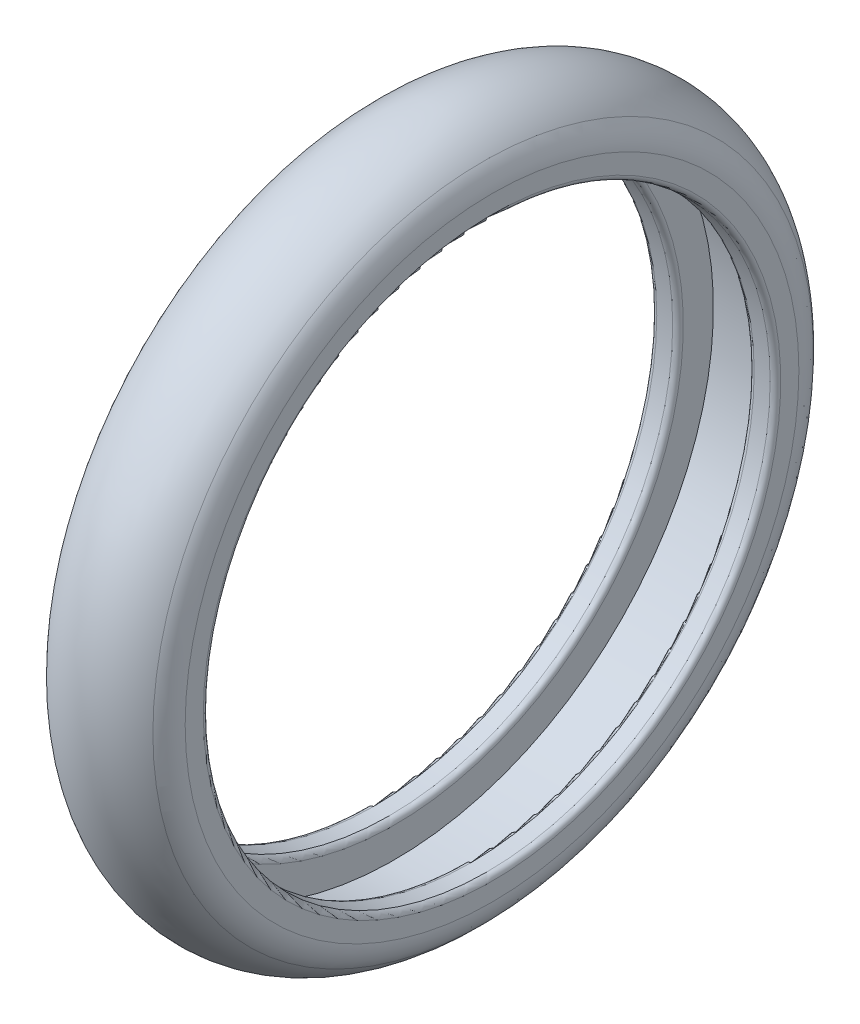
from build123d import *

# Parameters (mm, degrees)
VERRUNDUNG1_R = 2
VERRUNDUNG2_R = 0.3


with BuildPart() as part:
    # Skizze2 → Rotation1 (revolve)
    with BuildSketch(Plane.XY, mode=Mode.PRIVATE) as rotation1_sk:
        with BuildLine():
            Line((2, 18), (-2, 18))
            Line((-2, 18), (-2, 16))
            Line((-2, 16), (-3.5, 16))
            Line((-3.5, 16), (-3.5, 17.936491673))
            ThreePointArc((-3.5, 17.936491673), (0, 20), (3.5, 17.936491673))
            Line((3.5, 17.936491673), (3.5, 16))
            Line((3.5, 16), (2, 16))
            Line((2, 16), (2, 18))
        make_face()
    revolve(rotation1_sk.sketch.rotate(Axis((0, 0, 0), (1, 0, 0)), 90), axis=Axis((0, 0, 0), (1, 0, 0)))

    # Verrundung1
    verrundung1_edges = [part.edges().sort_by_distance(p)[0] for p in [
        (3.5, 0, -17.936491673),
        (-3.5, 0, -17.936491673),
    ]]
    fillet(verrundung1_edges, radius=VERRUNDUNG1_R)

    # Verrundung2
    verrundung2_edges = [part.edges().sort_by_distance(p)[0] for p in [
        (3.5, 0, -16),
        (-3.5, 0, -16),
        (-2, 0, -16),
        (2, 0, -16),
    ]]
    fillet(verrundung2_edges, radius=VERRUNDUNG2_R)


solid = part.part
